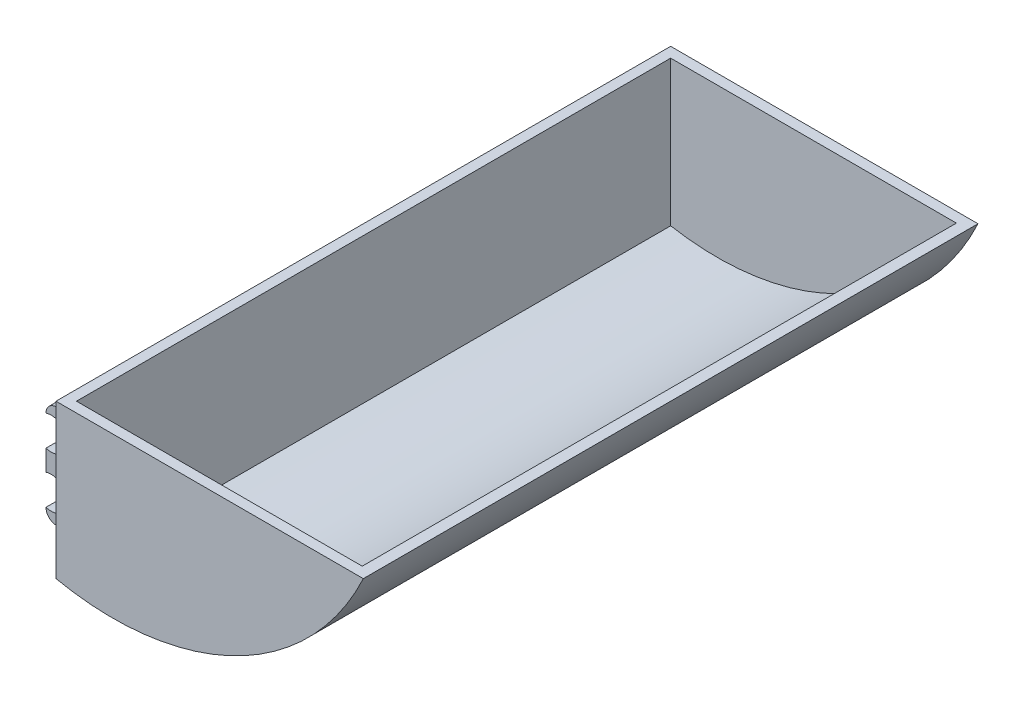
from build123d import *

# Parameters (mm, degrees)
BOSS_EXTRUDE1_DEPTH  = 152.4
SHELL1_T             = -2.54
SKETCH2_W            = 7.9375
SKETCH2_H            = 25.4
BOSS_EXTRUDE2_DEPTH  = 7.62
SKETCH3_R            = 3.9624
CUT_EXTRUDE1_DEPTH   = 12.7
FILLET1_R            = 2.54
FILLET1_OF_MIRROR1_R = 2.54


with BuildPart() as part:
    # Sketch1 → Boss-Extrude1 (new body)
    with BuildSketch(Plane.XY):
        with BuildLine():
            Line((0, 0), (0, 38.1))
            Line((0, 38.1), (76.2, 38.1))
            ThreePointArc((76.2, 38.1), (44.733669489, 5.782661022), (0, 0))
        make_face()
    extrude(amount=BOSS_EXTRUDE1_DEPTH)

    # Shell1
    shell1_openings = [part.faces().sort_by_distance(p)[0] for p in [
        (38.1, 38.1, 76.2),
    ]]
    offset(amount=SHELL1_T, openings=shell1_openings, kind=Kind.INTERSECTION)

    # Sketch2 → Boss-Extrude2 (add)
    with BuildSketch(Plane(origin=(0, 0, 0), x_dir=(0, 0, -1), z_dir=(1, 0, 0))):
        with Locations((-9.11225, 19.05)):
            Rectangle(SKETCH2_W, SKETCH2_H)
    boss_extrude2 = extrude(amount=-BOSS_EXTRUDE2_DEPTH)

    # Sketch3 → Cut-Extrude1 (cut)
    with BuildSketch(Plane(origin=(0, 0, 5.1435), x_dir=(-1, 0, 0), z_dir=(0, 0, -1))):
        with Locations((6.35, 25.4)):
            Circle(SKETCH3_R)
        with Locations((6.35, 12.7)):
            Circle(SKETCH3_R)
    cut_extrude1 = extrude(amount=-CUT_EXTRUDE1_DEPTH, mode=Mode.SUBTRACT)

    # Fillet1
    fillet1_edges = [part.edges().sort_by_distance(p)[0] for p in [
        (-7.62, 6.35, 9.11225),
        (-7.62, 31.75, 9.11225),
        (0, 31.75, 9.11225),
        (0, 6.35, 9.11225),
    ]]
    fillet(fillet1_edges, radius=FILLET1_R)

    # Mirror1: Boss-Extrude2, Cut-Extrude1 across plane
    add(boss_extrude2.mirror(Plane(origin=(0, 0, 76.2), x_dir=(1, 0, 0), z_dir=(0, 0, -1))))
    add(cut_extrude1.mirror(Plane(origin=(0, 0, 76.2), x_dir=(1, 0, 0), z_dir=(0, 0, -1))), mode=Mode.SUBTRACT)

    # Fillet1 of Mirror1
    fillet1_of_mirror1_edges = [part.edges().sort_by_distance(p)[0] for p in [
        (-7.62, 6.35, 143.28775),
        (-7.62, 31.75, 143.28775),
        (0, 31.75, 143.28775),
        (0, 6.35, 143.28775),
    ]]
    fillet(fillet1_of_mirror1_edges, radius=FILLET1_OF_MIRROR1_R)


solid = part.part
